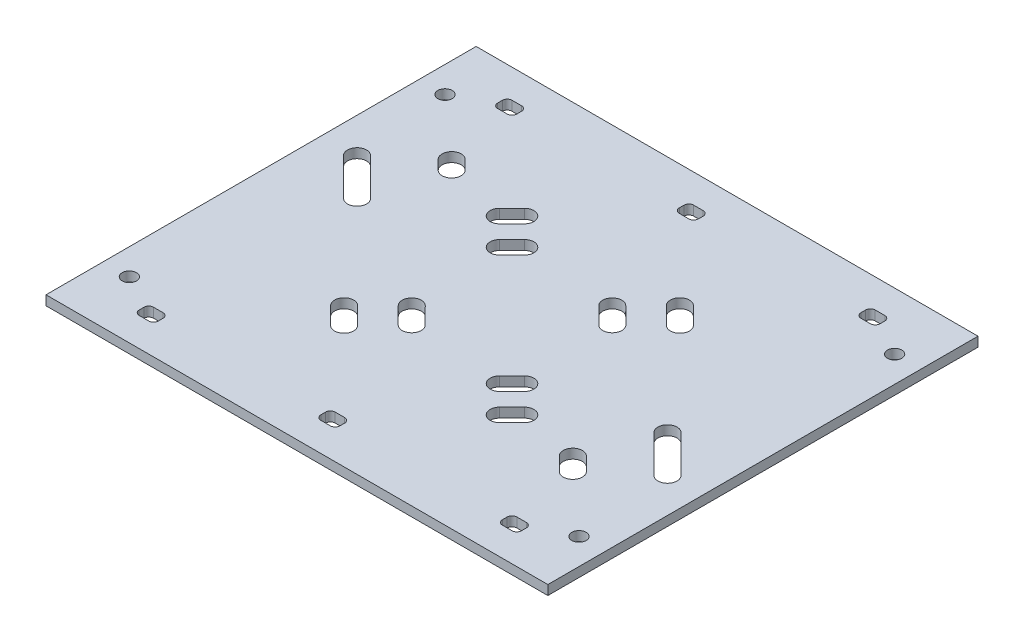
from build123d import *

# Parameters (mm, degrees)
SKETCH1_W                = 105
SKETCH1_H                = 90
BOSS_EXTRUDE1_DEPTH      = 2
M3_CLEARANCE_HOLE1_D     = 3
M3_CLEARANCE_HOLE1_DEPTH = 2
M3_CLEARANCE_HOLE1_TIP   = 0.901290929
SKETCH4_W                = 4
SKETCH4_H                = 3
CUT_EXTRUDE1_DEPTH       = 139.307628134
FILLET1_R                = 1
FILLET2_R                = 1
FILLET3_R                = 1
FILLET4_R                = 1
LPATTERN1_COUNT          = 2
LPATTERN1_PITCH          = 75
LPATTERN1_COUNT_DIR2     = 3
LPATTERN1_PITCH_DIR2     = 38
FILLET1_OF_LPATTERN1_R   = 1
FILLET2_OF_LPATTERN1_R   = 1
FILLET3_OF_LPATTERN1_R   = 1
FILLET4_OF_LPATTERN1_R   = 1
CUT_EXTRUDE2_DEPTH       = 139.307628134


with BuildPart() as part:
    # Sketch1 → Boss-Extrude1 (new body)
    with BuildSketch(Plane(origin=(0, 0, 0), x_dir=(1, 0, 0), z_dir=(0, 1, 0))):
        with Locations((52.5, 45)):
            Rectangle(SKETCH1_W, SKETCH1_H)
    extrude(amount=BOSS_EXTRUDE1_DEPTH)

    # M3 Clearance Hole1
    with Locations(Plane(origin=(0, 2, 0), x_dir=(1, 0, 0), z_dir=(0, 1, 0))):
        with Locations((5.46, 11.98), (5.46, 78.02), (99.54, 78.02), (99.54, 11.98)):
            Hole(M3_CLEARANCE_HOLE1_D / 2, depth=M3_CLEARANCE_HOLE1_DEPTH)
            with Locations((0, 0, -(M3_CLEARANCE_HOLE1_DEPTH + M3_CLEARANCE_HOLE1_TIP / 2))):  # 118° drill point
                Cone(0, M3_CLEARANCE_HOLE1_D / 2, M3_CLEARANCE_HOLE1_TIP, mode=Mode.SUBTRACT)

    # Sketch4 → Cut-Extrude1 (cut, through all)
    with BuildSketch(Plane(origin=(0, 2, 0), x_dir=(1, 0, 0), z_dir=(0, 1, 0))):
        with Locations((14.5, 82.5)):
            Rectangle(SKETCH4_W, SKETCH4_H)
    cut_extrude1 = extrude(amount=-CUT_EXTRUDE1_DEPTH, mode=Mode.SUBTRACT)

    # Fillet1
    fillet1_edges = [part.edges().sort_by_distance(p)[0] for p in [
        (12.5, 1, -84),
    ]]
    fillet(fillet1_edges, radius=FILLET1_R)

    # Fillet2
    fillet2_edges = [part.edges().sort_by_distance(p)[0] for p in [
        (12.5, 1, -81),
    ]]
    fillet(fillet2_edges, radius=FILLET2_R)

    # Fillet3
    fillet3_edges = [part.edges().sort_by_distance(p)[0] for p in [
        (16.5, 1, -84),
    ]]
    fillet(fillet3_edges, radius=FILLET3_R)

    # Fillet4
    fillet4_edges = [part.edges().sort_by_distance(p)[0] for p in [
        (16.5, 1, -81),
    ]]
    fillet(fillet4_edges, radius=FILLET4_R)

    # LPattern1: Cut-Extrude1 2 × 3
    with Locations(*[(j * LPATTERN1_PITCH_DIR2, 0, i * LPATTERN1_PITCH) for i in range(LPATTERN1_COUNT) for j in range(LPATTERN1_COUNT_DIR2) if (i, j) != (0, 0)]):
        add(cut_extrude1, mode=Mode.SUBTRACT)

    # Fillet1 of LPattern1
    fillet1_of_lpattern1_edges = [part.edges().sort_by_distance(p)[0] for p in [
        (50.5, 1, -84),
        (88.5, 1, -84),
        (12.5, 1, -9),
        (50.5, 1, -9),
        (88.5, 1, -9),
    ]]
    fillet(fillet1_of_lpattern1_edges, radius=FILLET1_OF_LPATTERN1_R)

    # Fillet2 of LPattern1
    fillet2_of_lpattern1_edges = [part.edges().sort_by_distance(p)[0] for p in [
        (50.5, 1, -81),
        (88.5, 1, -81),
        (12.5, 1, -6),
        (50.5, 1, -6),
        (88.5, 1, -6),
    ]]
    fillet(fillet2_of_lpattern1_edges, radius=FILLET2_OF_LPATTERN1_R)

    # Fillet3 of LPattern1
    fillet3_of_lpattern1_edges = [part.edges().sort_by_distance(p)[0] for p in [
        (54.5, 1, -84),
        (92.5, 1, -84),
        (16.5, 1, -9),
        (54.5, 1, -9),
        (92.5, 1, -9),
    ]]
    fillet(fillet3_of_lpattern1_edges, radius=FILLET3_OF_LPATTERN1_R)

    # Fillet4 of LPattern1
    fillet4_of_lpattern1_edges = [part.edges().sort_by_distance(p)[0] for p in [
        (54.5, 1, -81),
        (92.5, 1, -81),
        (16.5, 1, -6),
        (54.5, 1, -6),
        (92.5, 1, -6),
    ]]
    fillet(fillet4_of_lpattern1_edges, radius=FILLET4_OF_LPATTERN1_R)

    # Sketch6 → Cut-Extrude2 (cut, through all)
    with BuildSketch(Plane.XZ):
        with BuildLine():
            Line((31.726499367, -27.824570361), (35.324813273, -24.217791062))
            ThreePointArc((35.324813273, -24.217791062), (38.153238445, -24.214467895), (38.156561613, -27.042893068))
            Line((38.156561613, -27.042893068), (34.558247707, -30.649672366))
            ThreePointArc((34.558247707, -30.649672366), (31.729822534, -30.652995533), (31.726499367, -27.824570361))
        make_face()
        with BuildLine():
            Line((45.144836896, -34.196957958), (41.658406286, -37.691590744))
            ThreePointArc((41.658406286, -37.691590744), (38.829981114, -37.694913911), (38.826657946, -34.866488738))
            Line((38.826657946, -34.866488738), (42.313088556, -31.371855953))
            ThreePointArc((42.313088556, -31.371855953), (45.141513729, -31.368532786), (45.144836896, -34.196957958))
        make_face()
        with BuildLine():
            Line((69.676107758, -65.774178752), (73.282887056, -62.175864846))
            ThreePointArc((73.282887056, -62.175864846), (73.286210223, -59.347439673), (70.457785051, -59.344116506))
            Line((70.457785051, -59.344116506), (66.851005753, -62.942430412))
            ThreePointArc((66.851005753, -62.942430412), (66.847682586, -65.770855585), (69.676107758, -65.774178752))
        make_face()
        with BuildLine():
            Line((63.30372016, -52.355841223), (59.809087375, -55.842271833))
            ThreePointArc((59.809087375, -55.842271833), (59.805764208, -58.670697005), (62.63418938, -58.674020172))
            Line((62.63418938, -58.674020172), (66.128822166, -55.187589562))
            ThreePointArc((66.128822166, -55.187589562), (66.132145333, -52.35916439), (63.30372016, -52.355841223))
        make_face()
        with BuildLine():
            Line((99.169047558, -33.68696962), (91.390872965, -41.465144213))
            ThreePointArc((91.390872965, -41.465144213), (88.562445841, -41.465144213), (88.562445841, -38.636717088))
            Line((88.562445841, -38.636717088), (96.340620434, -30.858542495))
            ThreePointArc((96.340620434, -30.858542495), (99.169047558, -30.858542495), (99.169047558, -33.68696962))
        make_face()
        with BuildLine():
            Line((16.492855818, -51.419940807), (8.714681224, -59.1981154))
            ThreePointArc((8.714681224, -59.1981154), (5.8862541, -59.1981154), (5.8862541, -56.369688276))
            Line((5.8862541, -56.369688276), (13.664428693, -48.591513683))
            ThreePointArc((13.664428693, -48.591513683), (16.492855818, -48.591513683), (16.492855818, -51.419940807))
        make_face()
        with BuildLine():
            Line((16.492855818, -65.562076431), (18.455777203, -63.599155046))
            ThreePointArc((18.455777203, -63.599155046), (21.284204328, -63.599155046), (21.284204328, -66.42758217))
            Line((21.284204328, -66.42758217), (19.321282942, -68.390503556))
            ThreePointArc((19.321282942, -68.390503556), (16.492855818, -68.390503556), (16.492855818, -65.562076431))
        make_face()
        with BuildLine():
            Line((88.562445841, -24.494581464), (85.734018716, -27.323008589))
            ThreePointArc((85.734018716, -27.323008589), (82.905591591, -27.323008589), (82.905591591, -24.494581464))
            Line((82.905591591, -24.494581464), (85.734018716, -21.666154339))
            ThreePointArc((85.734018716, -21.666154339), (88.562445841, -21.666154339), (88.562445841, -24.494581464))
        make_face()
        with BuildLine():
            Line((34.618363651, -60.312489091), (37.188189027, -62.882314467))
            ThreePointArc((37.188189027, -62.882314467), (37.188189027, -65.710741592), (34.359761903, -65.710741592))
            Line((34.359761903, -65.710741592), (31.789936526, -63.140916216))
            ThreePointArc((31.789936526, -63.140916216), (31.789936526, -60.312489091), (34.618363651, -60.312489091))
        make_face()
        with BuildLine():
            Line((67.811810973, -27.11904177), (70.381636349, -29.688867146))
            ThreePointArc((70.381636349, -29.688867146), (73.210063474, -29.688867146), (73.210063474, -26.860440021))
            Line((73.210063474, -26.860440021), (70.640238097, -24.290614645))
            ThreePointArc((70.640238097, -24.290614645), (67.811810973, -24.290614645), (67.811810973, -27.11904177))
        make_face()
        with BuildLine():
            Line((40.278245356, -54.658662907), (42.845042972, -57.225460523))
            ThreePointArc((42.845042972, -57.225460523), (42.845042972, -60.053887648), (40.016615847, -60.053887648))
            Line((40.016615847, -60.053887648), (37.449818231, -57.487090032))
            ThreePointArc((37.449818231, -57.487090032), (37.449818231, -54.658662907), (40.278245356, -54.658662907))
        make_face()
        with BuildLine():
            Line((62.157984789, -32.778923475), (64.724782404, -35.345721091))
            ThreePointArc((64.724782404, -35.345721091), (67.553209529, -35.345721091), (67.553209529, -32.517293966))
            Line((67.553209529, -32.517293966), (64.986411913, -29.95049635))
            ThreePointArc((64.986411913, -29.95049635), (62.157984789, -29.95049635), (62.157984789, -32.778923475))
        make_face()
    extrude(amount=-CUT_EXTRUDE2_DEPTH, mode=Mode.SUBTRACT)


solid = part.part
